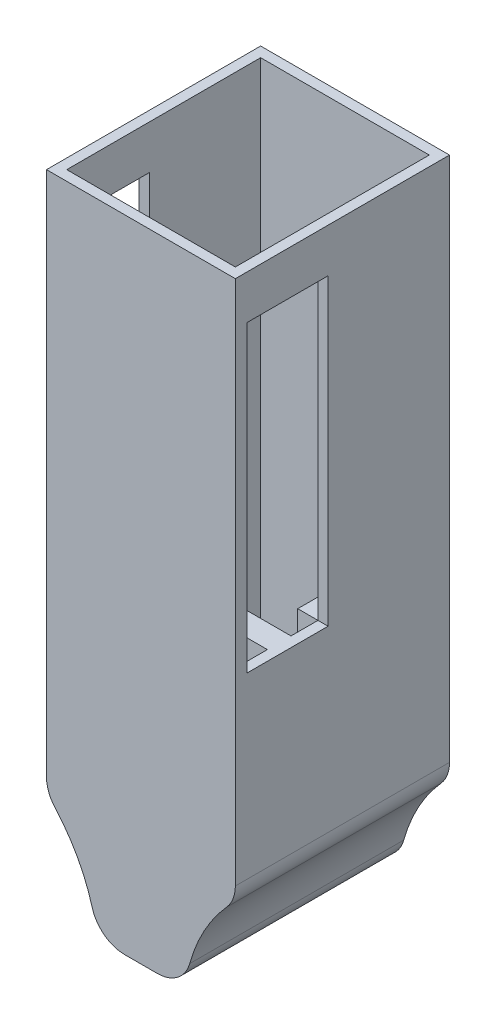
from build123d import *

# Parameters (mm, degrees)
CROQUIS2_W              = 56
CROQUIS2_H              = 190
SALIENTE_EXTRUIR1_DEPTH = 63.5
CORTAR_EXTRUIR6_DEPTH   = 65
REDONDEO1_R             = 10
VACIADO2_T              = -3
CROQUIS10_W             = 24
CROQUIS10_H             = 90
CORTAR_EXTRUIR1_DEPTH   = 129
CROQUIS12_W             = 50
CROQUIS12_H             = 7
SALIENTE_EXTRUIR2_DEPTH = 84
CROQUIS13_W             = 8
CROQUIS13_H             = 7.031646252
CORTAR_EXTRUIR2_DEPTH   = 84
CROQUIS14_R             = 5
CORTAR_EXTRUIR3_DEPTH   = 84
CORTAR_EXTRUIR5_DEPTH   = 10
CROQUIS18_W             = 15
CROQUIS18_H             = 57
SALIENTE_EXTRUIR4_DEPTH = 6
CROQUIS19_W             = 15
CROQUIS19_H             = 57
SALIENTE_EXTRUIR5_DEPTH = 6
CROQUIS22_R             = 5
CROQUIS22_W             = 13.6
CROQUIS22_H             = 6.2
CORTAR_EXTRUIR7_DEPTH   = 20
CROQUIS23_W             = 13.6
CROQUIS23_H             = 7
CORTAR_EXTRUIR8_DEPTH   = 10


with BuildPart() as part:
    # Croquis2 → Saliente-Extruir1 (new body)
    with BuildSketch(Plane.XY):
        Rectangle(CROQUIS2_W, CROQUIS2_H)
    extrude(amount=SALIENTE_EXTRUIR1_DEPTH)

    # Croquis20 → Cortar-Extruir6 (cut)
    with BuildSketch(Plane.XY.offset(63.5)):
        with BuildLine():
            Line((-13, -95), (-28, -95))
            Line((-28, -95), (-28, -65))
            ThreePointArc((-28, -65), (-17.909389316, -78.704694658), (-13, -95))
        make_face()
        with BuildLine():
            Line((13, -95), (28, -95))
            Line((28, -95), (28, -65))
            ThreePointArc((28, -65), (17.909389316, -78.704694658), (13, -95))
        make_face()
    extrude(amount=-CORTAR_EXTRUIR6_DEPTH, mode=Mode.SUBTRACT)

    # Redondeo1
    redondeo1_edges = [part.edges().sort_by_distance(p)[0] for p in [
        (13, -95, 31.75),
        (28, -65, 31.75),
        (-28, -65, 31.75),
        (-13, -95, 31.75),
    ]]
    fillet(redondeo1_edges, radius=REDONDEO1_R)

    # Vaciado2
    vaciado2_openings = [part.faces().sort_by_distance(p)[0] for p in [
        (0, 95, 31.75),
    ]]
    offset(amount=VACIADO2_T, openings=vaciado2_openings, kind=Kind.INTERSECTION)

    # Croquis10 → Cortar-Extruir1 (cut)
    with BuildSketch(Plane(origin=(28, 0, 0), x_dir=(0, 0, -1), z_dir=(1, 0, 0))):
        with Locations((-48, 37)):
            Rectangle(CROQUIS10_W, CROQUIS10_H)
    extrude(amount=-CORTAR_EXTRUIR1_DEPTH, mode=Mode.SUBTRACT)

    # Croquis12 → Saliente-Extruir2 (add)
    with BuildSketch(Plane(origin=(0, -92, 0), x_dir=(1, 0, 0), z_dir=(0, 1, 0))):
        with Locations((0, -47.5)):
            Rectangle(CROQUIS12_W, CROQUIS12_H)
    extrude(amount=SALIENTE_EXTRUIR2_DEPTH)

    # Croquis13 → Cortar-Extruir2 (cut)
    with BuildSketch(Plane(origin=(0, -8, 0), x_dir=(1, 0, 0), z_dir=(0, 1, 0))):
        with Locations((0, -47.515823126)):
            Rectangle(CROQUIS13_W, CROQUIS13_H)
    extrude(amount=-CORTAR_EXTRUIR2_DEPTH, mode=Mode.SUBTRACT)

    # Croquis14 → Cortar-Extruir3 (cut)
    with BuildSketch(Plane.XZ.offset(95)):
        with Locations(Location((0, 28, 0), (0, 0, 344.646267442))):
            Circle(CROQUIS14_R)
    extrude(amount=-CORTAR_EXTRUIR3_DEPTH, mode=Mode.SUBTRACT)

    # Croquis17 → Cortar-Extruir5 (cut)
    with BuildSketch(Plane(origin=(0, 0, 44), x_dir=(-1, 0, 0), z_dir=(0, 0, -1))):
        with BuildLine():
            Line((11.962976086, -92), (25, -92))
            Line((25, -92), (25, -68.142331746))
            ThreePointArc((25, -68.142331746), (18.630358126, -77.31741421), (14.456414526, -87.677562405))
            ThreePointArc((14.456414526, -87.677562405), (13.483642535, -89.996810217), (11.962976086, -92))
        make_face()
        with BuildLine():
            Line((-25, -68.142331746), (-25, -92))
            Line((-25, -92), (-11.962976086, -92))
            ThreePointArc((-11.962976086, -92), (-13.483642535, -89.996810217), (-14.456414526, -87.677562405))
            ThreePointArc((-14.456414526, -87.677562405), (-18.630358126, -77.31741421), (-25, -68.142331746))
        make_face()
    extrude(amount=-CORTAR_EXTRUIR5_DEPTH, mode=Mode.SUBTRACT)

    # Croquis22 → Cortar-Extruir7 (cut)
    with BuildSketch(Plane.XZ.offset(95)):
        with Locations(Location((0, 28, 0), (0, 0, 344.646267442))):
            Circle(CROQUIS22_R)
        with Locations((0.021547658, 47.4)):
            Rectangle(CROQUIS22_W, CROQUIS22_H)
    extrude(amount=-CORTAR_EXTRUIR7_DEPTH, mode=Mode.SUBTRACT)

    # Croquis23 → Cortar-Extruir8 (cut)
    with BuildSketch(Plane.XZ.offset(75)):
        with Locations((0.021547658, 47.5)):
            Rectangle(CROQUIS23_W, CROQUIS23_H)
    extrude(amount=-CORTAR_EXTRUIR8_DEPTH, mode=Mode.SUBTRACT)


with BuildPart() as body_2:
    # Croquis18 → Saliente-Extruir4 (new body)
    with BuildSketch(Plane(origin=(-25, 0, 0), x_dir=(0, 0, -1), z_dir=(1, 0, 0))):
        with Locations((-28.5, -36.5)):
            Rectangle(CROQUIS18_W, CROQUIS18_H)
    extrude(amount=SALIENTE_EXTRUIR4_DEPTH)


with BuildPart() as body_3:
    # Croquis19 → Saliente-Extruir5 (new body)
    with BuildSketch(Plane.ZY.offset(-25)):
        with Locations((28.5, -36.5)):
            Rectangle(CROQUIS19_W, CROQUIS19_H)
    extrude(amount=SALIENTE_EXTRUIR5_DEPTH)


solid = Compound([part.part, body_2.part, body_3.part])
